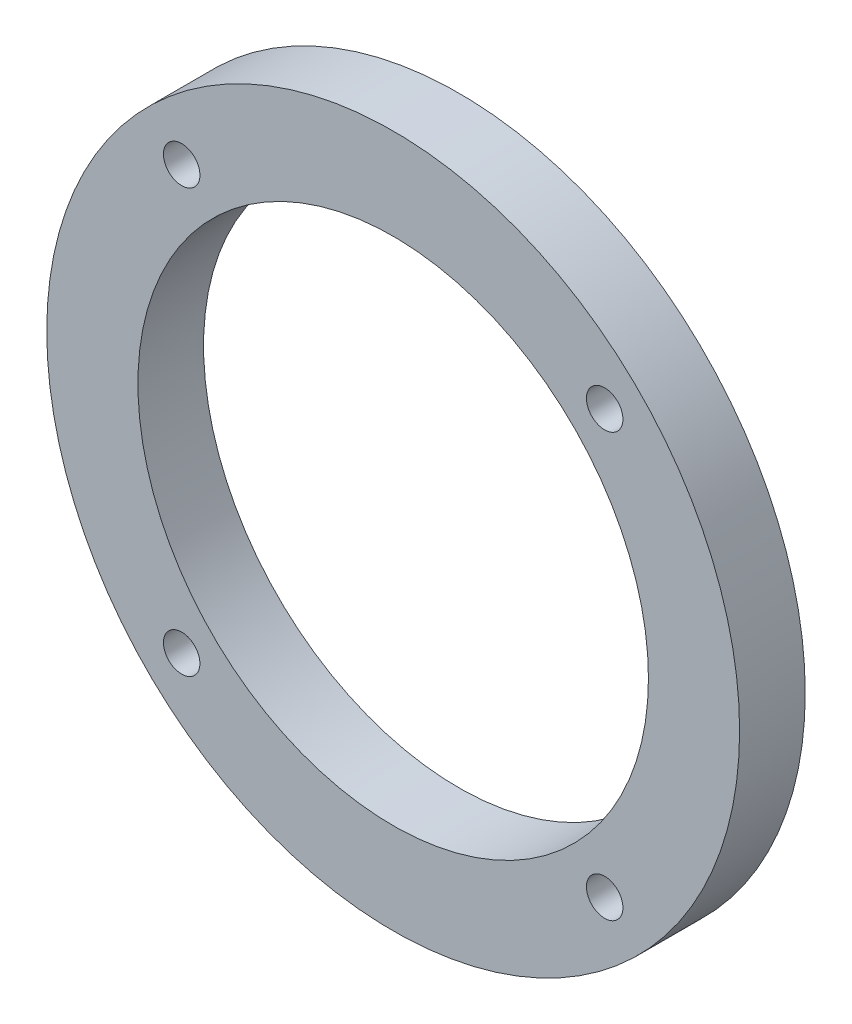
from build123d import *

# Parameters (mm, degrees)
SKETCH_1_R          = 47.5
SKETCH_1_R_2        = 35
EXTRUDE_1_DEPTH     = 9
SKETCH_2_R          = 2.5
CUT_EXTRUDE_1_DEPTH = 10


with BuildPart() as part:
    # 草图1 → 凸台-拉伸1 (new body)
    with BuildSketch(Plane.XY):
        Circle(SKETCH_1_R)
        Circle(SKETCH_1_R_2, mode=Mode.SUBTRACT)
    extrude(amount=EXTRUDE_1_DEPTH)

    # 草图2 → 切除-拉伸1 (cut)
    with BuildSketch(Plane.XY.offset(9)):
        with Locations((29, 29)):
            Circle(SKETCH_2_R)
        with Locations((29, -29)):
            Circle(SKETCH_2_R)
        with Locations((-29, -29)):
            Circle(SKETCH_2_R)
        with Locations((-29, 29)):
            Circle(SKETCH_2_R)
    extrude(amount=-CUT_EXTRUDE_1_DEPTH, mode=Mode.SUBTRACT)


solid = part.part
